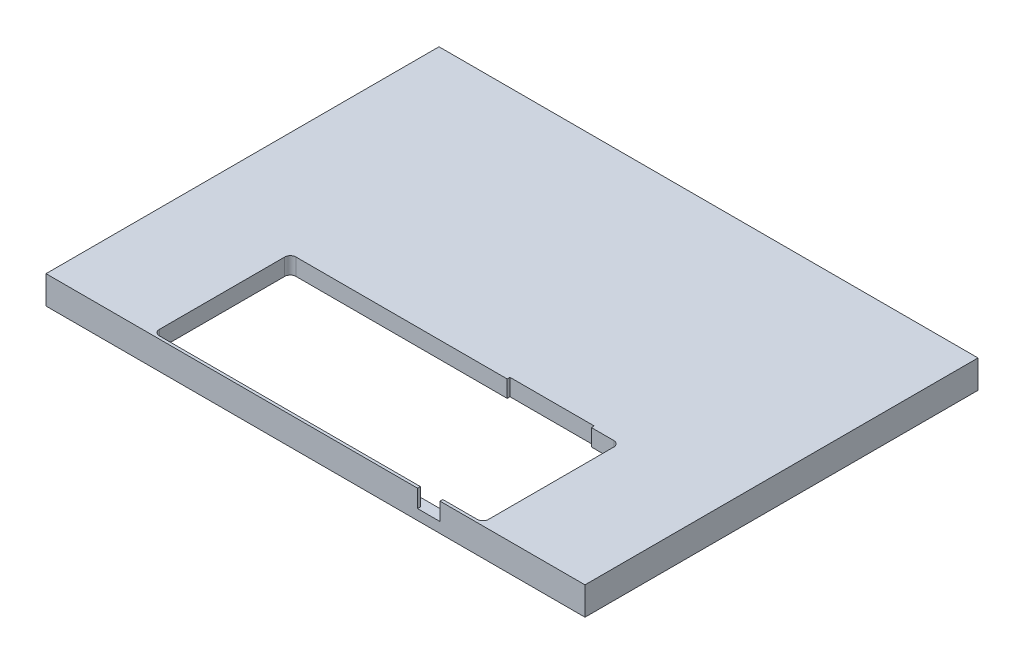
from build123d import *

# Parameters (mm, degrees)
SKETCH1_W           = 243.84
SKETCH1_H           = 177.8
SKETCH1_W_2         = 233.68
SKETCH1_H_2         = 167.64
BOSS_EXTRUDE7_DEPTH = 12.7
SKETCH6_W           = 233.68
SKETCH6_H           = 167.64
BOSS_EXTRUDE8_DEPTH = 7.62
CUT_EXTRUDE2_DEPTH  = 8
FILLET1_R           = 2.54


with BuildPart() as part:
    # Sketch1 → Boss-Extrude7 (new body)
    with BuildSketch(Plane(origin=(0, 0, 0), x_dir=(1, 0, 0), z_dir=(0, 1, 0))):
        with Locations((121.92, 88.9)):
            Rectangle(SKETCH1_W, SKETCH1_H)
        with Locations((121.92, 88.9)):
            Rectangle(SKETCH1_W_2, SKETCH1_H_2, mode=Mode.SUBTRACT)
    extrude(amount=BOSS_EXTRUDE7_DEPTH)

    # Sketch6 → Boss-Extrude8 (add)
    with BuildSketch(Plane(origin=(0, 12.7, 0), x_dir=(1, 0, 0), z_dir=(0, 1, 0))):
        with Locations((121.92, 88.9)):
            Rectangle(SKETCH6_W, SKETCH6_H)
    extrude(amount=-BOSS_EXTRUDE8_DEPTH)

    # Sketch7 → Cut-Extrude2 (cut)
    with BuildSketch(Plane(origin=(0, 12.7, 0), x_dir=(1, 0, 0), z_dir=(0, 1, 0))):
        Polygon((196.37, 1.27), (178.258137899, 1.27), (178.258137899, 0), (168.098137899, 0), (168.098137899, 1.27), (157.995367116, 1.27), (47.47, 1.27), (47.47, 63.07), (145.57, 63.07), (145.57, 64.34), (183.67, 64.34), (183.67, 63.07), (196.37, 63.07), align=None)
    extrude(amount=-CUT_EXTRUDE2_DEPTH, mode=Mode.SUBTRACT)

    # Fillet1
    fillet1_edges = [part.edges().sort_by_distance(p)[0] for p in [
        (47.47, 8.89, -63.07),
        (47.47, 8.7, -1.27),
        (196.37, 8.89, -63.07),
        (196.37, 8.7, -1.27),
    ]]
    fillet(fillet1_edges, radius=FILLET1_R)


solid = part.part
